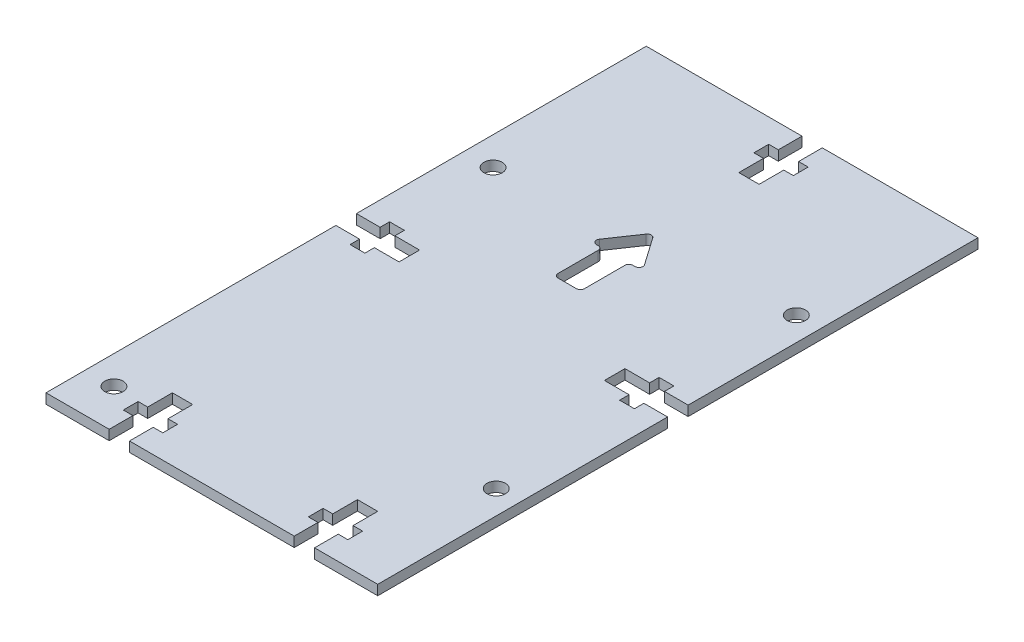
from build123d import *

# Parameters (mm, degrees)
SKETCH1_W                       = 53.34
SKETCH1_H                       = 96.52
BOSS_EXTRUDE1_DEPTH             = 1.6002
CUT_EXTRUDE1_DEPTH              = 1.6002
F_32_0_116_DIAMETER_HOLE1_D     = 2.9464
F_32_0_116_DIAMETER_HOLE1_DEPTH = 25.4
F_32_0_116_DIAMETER_HOLE1_TIP   = 0.885187864
CUT_EXTRUDE2_DEPTH              = 2.54
FILLET1_R                       = 0.635


with BuildPart() as part:
    # Sketch1 → Boss-Extrude1 (new body)
    with BuildSketch(Plane(origin=(0, 0, 0), x_dir=(1, 0, 0), z_dir=(0, 1, 0))):
        with Locations((26.67, 48.26)):
            Rectangle(SKETCH1_W, SKETCH1_H)
    extrude(amount=BOSS_EXTRUDE1_DEPTH)

    # Sketch2 → Cut-Extrude1 (cut)
    with BuildSketch(Plane(origin=(0, 1.6002, 0), x_dir=(1, 0, 0), z_dir=(0, 1, 0))):
        Polygon((10.16, 0), (10.16, 3.81), (8.61695, 3.81), (8.61695, 6.19125), (10.16, 6.19125), (10.16, 10.16), (13.4239, 10.16), (13.4239, 6.19125), (14.96695, 6.19125), (14.96695, 3.81), (13.4239, 3.81), (13.4239, 0), align=None)
        Polygon((28.30195, 96.52), (28.30195, 92.71), (29.845, 92.71), (29.845, 90.32875), (28.30195, 90.32875), (28.30195, 86.36), (25.03805, 86.36), (25.03805, 90.32875), (23.495, 90.32875), (23.495, 92.71), (25.03805, 92.71), (25.03805, 96.52), align=None)
        Polygon((39.9161, 0), (43.18, 0), (43.18, 3.81), (44.72305, 3.81), (44.72305, 6.19125), (43.18, 6.19125), (43.18, 10.16), (39.9161, 10.16), (39.9161, 6.19125), (38.37305, 6.19125), (38.37305, 3.81), (39.9161, 3.81), align=None)
        Polygon((0, 49.911), (3.81, 49.911), (3.81, 51.435), (6.19125, 51.435), (6.19125, 49.911), (10.16, 49.911), (10.16, 46.609), (6.19125, 46.609), (6.19125, 45.085), (3.81, 45.085), (3.81, 46.609), (0, 46.609), align=None)
        Polygon((53.34, 46.609), (53.34, 49.911), (49.53, 49.911), (49.53, 51.435), (47.14875, 51.435), (47.14875, 49.911), (43.18, 49.911), (43.18, 46.609), (47.14875, 46.609), (47.14875, 45.085), (49.53, 45.085), (49.53, 46.609), align=None)
    extrude(amount=-CUT_EXTRUDE1_DEPTH, mode=Mode.SUBTRACT)

    # #32 (0.116) Diameter Hole1
    with Locations(Plane(origin=(0, 1.6002, 0), x_dir=(1, 0, 0), z_dir=(0, 1, 0))):
        with Locations((4.572, 6.35), (49.53, 22.86), (49.53, 71.12), (4.572, 67.31)):
            Hole(F_32_0_116_DIAMETER_HOLE1_D / 2, depth=F_32_0_116_DIAMETER_HOLE1_DEPTH)
            with Locations((0, 0, -(F_32_0_116_DIAMETER_HOLE1_DEPTH + F_32_0_116_DIAMETER_HOLE1_TIP / 2))):  # 118° drill point
                Cone(0, F_32_0_116_DIAMETER_HOLE1_D / 2, F_32_0_116_DIAMETER_HOLE1_TIP, mode=Mode.SUBTRACT)

    # Sketch7 → Cut-Extrude2 (cut)
    with BuildSketch(Plane(origin=(0, 1.6002, 0), x_dir=(1, 0, 0), z_dir=(0, 1, 0))):
        Polygon((26.67, 71.12), (22.426456564, 64.879494947), (24.548228282, 64.879494947), (24.548228282, 57.141268682), (26.67, 57.141268682), (28.791771718, 57.141268682), (28.791771718, 64.937563076), (30.997705847, 64.937563076), align=None)
    extrude(amount=-CUT_EXTRUDE2_DEPTH, mode=Mode.SUBTRACT)

    # Fillet1
    fillet1_edges = [part.edges().sort_by_distance(p)[0] for p in [
        (26.67, 0.8001, -71.12),
        (30.997705847, 0.8001, -64.937563076),
        (28.791771718, 0.8001, -64.937563076),
        (28.791771718, 0.8001, -57.141268682),
        (24.548228282, 0.8001, -57.141268682),
        (24.548228282, 0.8001, -64.879494947),
        (22.426456564, 0.8001, -64.879494947),
    ]]
    fillet(fillet1_edges, radius=FILLET1_R)


solid = part.part
